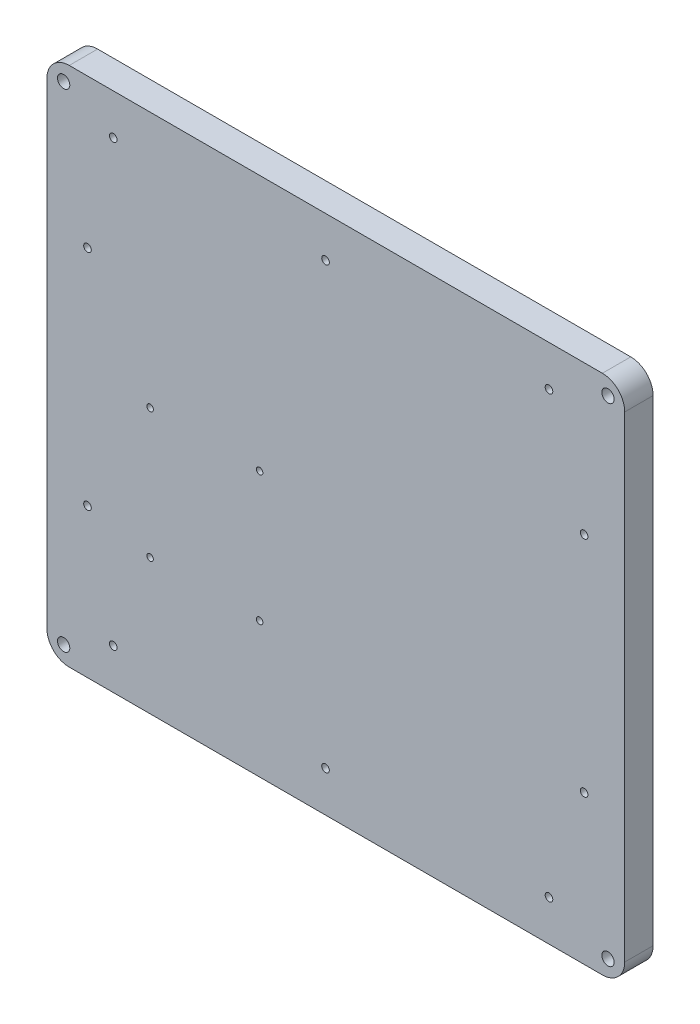
from build123d import *

# Parameters (mm, degrees)
PLACA_INFERIOR_1_2IN_DEPTH              = 12.7
CROQUIS20_R                             = 2.75
ANCLAJES_4XM5_DEPTH                     = 12.7
CROQUIS21_R                             = 1.7
CROQUIS21_R_2                           = 1.45
BARRENOS_M3_PAREDES_Y_M2_5_POSTES_DEPTH = 12.7
CROQUIS22_R                             = 2.9
REFRENTADO_M3_INFERIOR_DEPTH            = 3.2
CROQUIS23_R                             = 2.5
REFRENTADO_M2_5_INFERIOR_DEPTH          = 2.6


with BuildPart() as part:
    # Croquis19 → Placa_inferior_1-2in (new body)
    with BuildSketch(Plane.XY):
        with BuildLine():
            Line((-144.7, -116.6), (93.9, -116.6))
            ThreePointArc((93.9, -116.6), (100.971067812, -113.671067812), (103.9, -106.6))
            Line((103.9, -106.6), (103.9, 106.6))
            ThreePointArc((103.9, 106.6), (100.971067812, 113.671067812), (93.9, 116.6))
            Line((93.9, 116.6), (-144.7, 116.6))
            ThreePointArc((-144.7, 116.6), (-151.771067812, 113.671067812), (-154.7, 106.6))
            Line((-154.7, 106.6), (-154.7, -106.6))
            ThreePointArc((-154.7, -106.6), (-151.771067812, -113.671067812), (-144.7, -116.6))
        make_face()
    extrude(amount=PLACA_INFERIOR_1_2IN_DEPTH)

    # Croquis20 → Anclajes_4xM5 (cut)
    with BuildSketch(Plane.XY):
        with Locations((-147.2, -109.1)):
            Circle(CROQUIS20_R)
        with Locations((-147.2, 109.1)):
            Circle(CROQUIS20_R)
        with Locations((96.4, -109.1)):
            Circle(CROQUIS20_R)
        with Locations((96.4, 109.1)):
            Circle(CROQUIS20_R)
    extrude(amount=ANCLAJES_4XM5_DEPTH, mode=Mode.SUBTRACT)

    # Croquis21 → Barrenos_M3_paredes_y_M2-5_postes (cut)
    with BuildSketch(Plane.XY):
        with Locations((-125, 98.425)):
            Circle(CROQUIS21_R)
        with Locations((-125, -98.425)):
            Circle(CROQUIS21_R)
        with Locations((-30, 98.425)):
            Circle(CROQUIS21_R)
        with Locations((-30, -98.425)):
            Circle(CROQUIS21_R)
        with Locations((70, 98.425)):
            Circle(CROQUIS21_R)
        with Locations((70, -98.425)):
            Circle(CROQUIS21_R)
        with Locations((-136.525, -50)):
            Circle(CROQUIS21_R)
        with Locations((-136.525, 50)):
            Circle(CROQUIS21_R)
        with Locations((85.725, -50)):
            Circle(CROQUIS21_R)
        with Locations((85.725, 50)):
            Circle(CROQUIS21_R)
        with Locations((-108.5, -56)):
            Circle(CROQUIS21_R_2)
        with Locations((-108.5, 2)):
            Circle(CROQUIS21_R_2)
        with Locations((-59.5, -56)):
            Circle(CROQUIS21_R_2)
        with Locations((-59.5, 2)):
            Circle(CROQUIS21_R_2)
    extrude(amount=BARRENOS_M3_PAREDES_Y_M2_5_POSTES_DEPTH, mode=Mode.SUBTRACT)

    # Croquis22 → Refrentado_M3_inferior (cut)
    with BuildSketch(Plane.XY):
        with Locations((-125, 98.425)):
            Circle(CROQUIS22_R)
        with Locations((-125, -98.425)):
            Circle(CROQUIS22_R)
        with Locations((-30, 98.425)):
            Circle(CROQUIS22_R)
        with Locations((-30, -98.425)):
            Circle(CROQUIS22_R)
        with Locations((70, 98.425)):
            Circle(CROQUIS22_R)
        with Locations((70, -98.425)):
            Circle(CROQUIS22_R)
        with Locations((-136.525, -50)):
            Circle(CROQUIS22_R)
        with Locations((-136.525, 50)):
            Circle(CROQUIS22_R)
        with Locations((85.725, -50)):
            Circle(CROQUIS22_R)
        with Locations((85.725, 50)):
            Circle(CROQUIS22_R)
    extrude(amount=REFRENTADO_M3_INFERIOR_DEPTH, mode=Mode.SUBTRACT)

    # Croquis23 → Refrentado_M2-5_inferior (cut)
    with BuildSketch(Plane.XY):
        with Locations((-108.5, -56)):
            Circle(CROQUIS23_R)
        with Locations((-108.5, 2)):
            Circle(CROQUIS23_R)
        with Locations((-59.5, -56)):
            Circle(CROQUIS23_R)
        with Locations((-59.5, 2)):
            Circle(CROQUIS23_R)
    extrude(amount=REFRENTADO_M2_5_INFERIOR_DEPTH, mode=Mode.SUBTRACT)


solid = part.part
